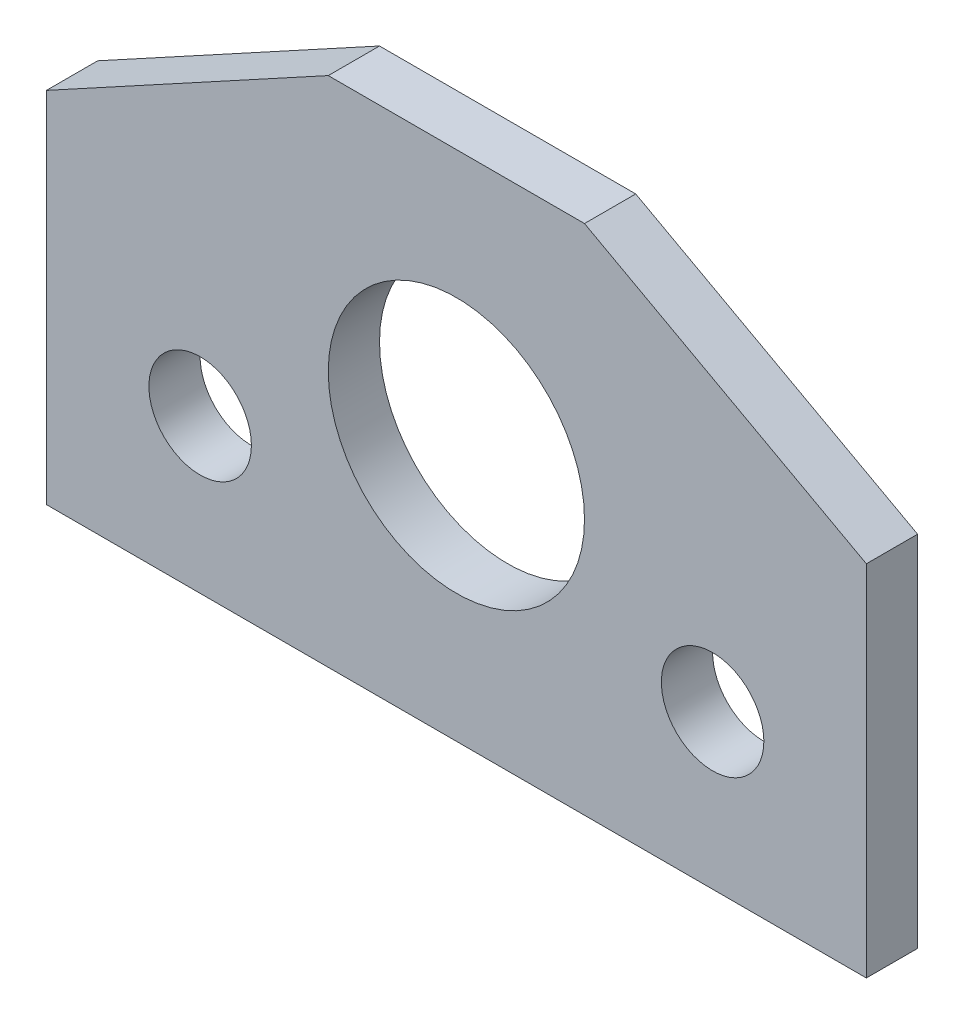
from build123d import *

# Parameters (mm, degrees)
SKETCH1_W           = 101.6
SKETCH1_H           = 63.5
BOSS_EXTRUDE1_DEPTH = 6.35
SKETCH2_R           = 6.35
SKETCH2_R_2         = 15.875
CUT_EXTRUDE1_DEPTH  = 6.35


with BuildPart() as part:
    # Sketch1 → Boss-Extrude1 (new body)
    with BuildSketch(Plane.XY):
        with Locations((50.8, 31.75)):
            Rectangle(SKETCH1_W, SKETCH1_H)
    extrude(amount=BOSS_EXTRUDE1_DEPTH)

    # Sketch2 → Cut-Extrude1 (cut)
    with BuildSketch(Plane.XY.offset(6.35)):
        Polygon((0, 63.5), (0, 44.45), (34.925, 63.5), align=None)
        Polygon((101.6, 63.5), (66.675, 63.5), (101.6, 44.45), align=None)
        with Locations((82.55, 19.05)):
            Circle(SKETCH2_R)
        with Locations((50.8, 31.75)):
            Circle(SKETCH2_R_2)
        with Locations((19.05, 19.05)):
            Circle(SKETCH2_R)
    extrude(amount=-CUT_EXTRUDE1_DEPTH, mode=Mode.SUBTRACT)


solid = part.part
